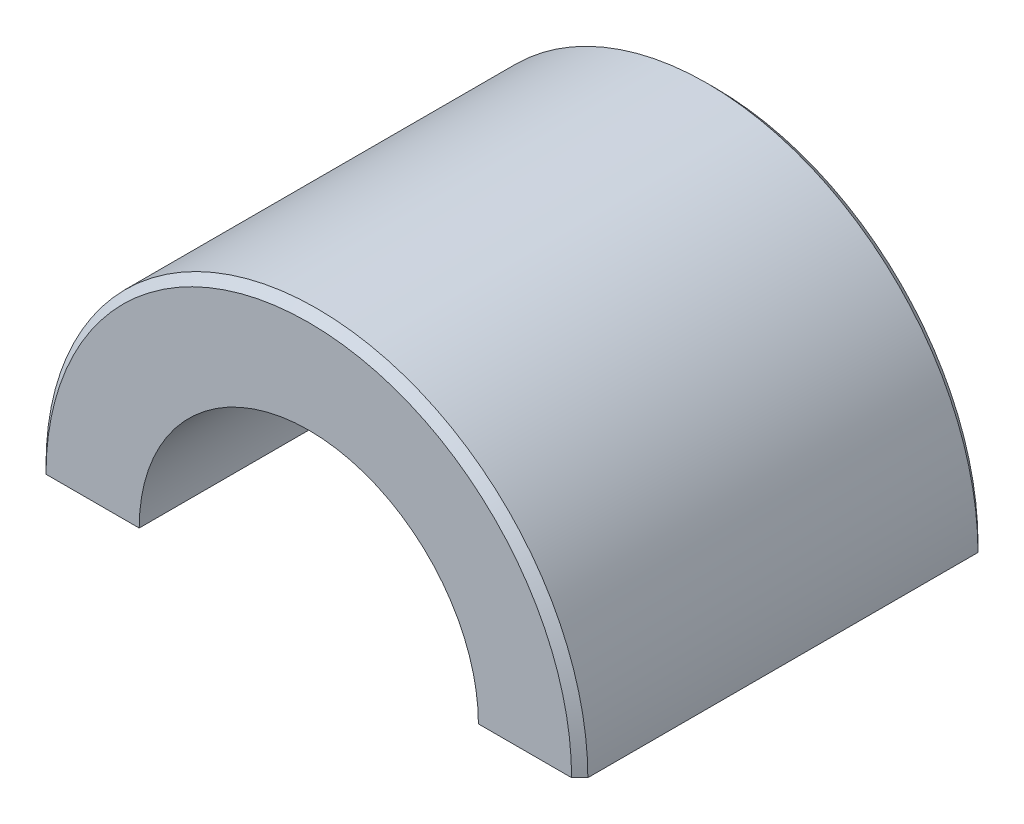
from build123d import *

# Parameters (mm, degrees)
BOSS_EXTRUDE1_DEPTH = 19.05
CHAMFER1_SIZE       = 0.381


with BuildPart() as part:
    # Sketch1 → Boss-Extrude1 (new body)
    with BuildSketch(Plane.XY):
        with BuildLine():
            Line((-7.9502, 0), (-12.7, 0))
            ThreePointArc((-12.7, 0), (0, 12.7), (12.7, 0))
            Line((12.7, 0), (7.9502, 0))
            ThreePointArc((7.9502, 0), (0, 7.9502), (-7.9502, 0))
        make_face()
    extrude(amount=BOSS_EXTRUDE1_DEPTH)

    # Chamfer1
    chamfer1_edges = [part.edges().sort_by_distance(p)[0] for p in [
        (0, 12.7, 19.05),
        (0, 12.7, 0),
    ]]
    chamfer(chamfer1_edges, length=CHAMFER1_SIZE)


solid = part.part
